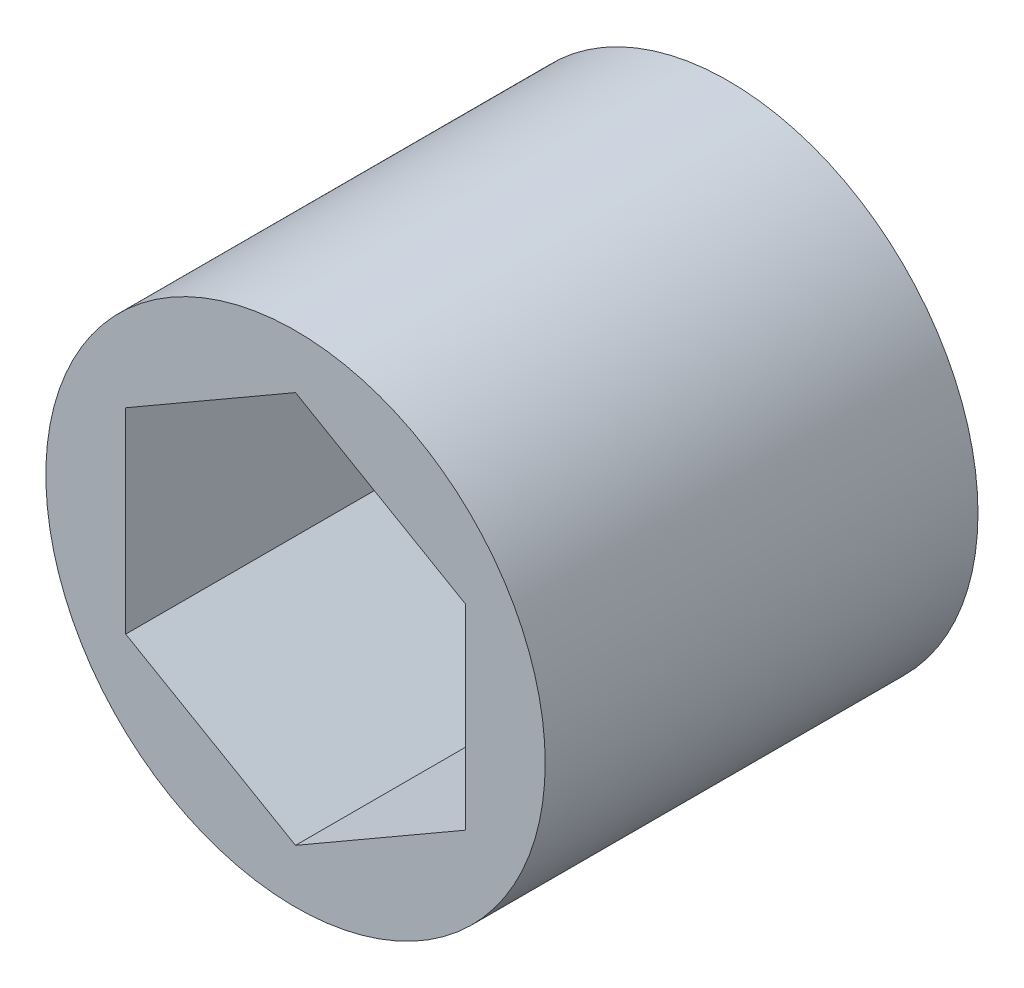
from build123d import *

# Parameters (mm, degrees)
SKETCH1_R           = 9.525
BOSS_EXTRUDE1_DEPTH = 8.255


with BuildPart() as part:
    # Sketch1 → Boss-Extrude1 (new, symmetric)
    with BuildSketch(Plane.XY):
        Circle(SKETCH1_R)
        Polygon((0, 7.478995387), (-6.477, 3.739497694), (-6.477, -3.739497694), (0, -7.478995387), (6.477, -3.739497694), (6.477, 3.739497694), align=None, mode=Mode.SUBTRACT)
    extrude(amount=BOSS_EXTRUDE1_DEPTH, both=True)


solid = part.part
